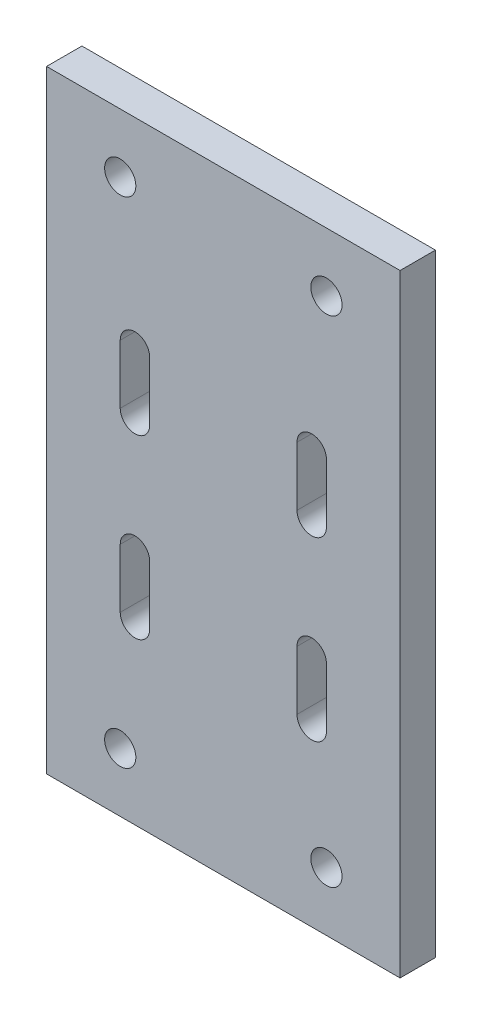
from build123d import *

# Parameters (mm, degrees)
SKETCH_1_W          = 60
SKETCH_1_H          = 104
EXTRUDE_1_DEPTH     = 6
CUT_EXTRUDE_1_DEPTH = 6
SKETCH_4_R          = 2.65
CUT_EXTRUDE_2_DEPTH = 6


with BuildPart() as part:
    # 草图1 → 凸台-拉伸1 (new body)
    with BuildSketch(Plane.XY):
        Rectangle(SKETCH_1_W, SKETCH_1_H)
    extrude(amount=EXTRUDE_1_DEPTH)

    # 草图2 → 切除-拉伸1 (cut)
    with BuildSketch(Plane.XY.offset(6)):
        with BuildLine():
            Line((-12.5, 18), (-12.5, 8))
            ThreePointArc((-12.5, 8), (-15, 5.5), (-17.5, 8))
            Line((-17.5, 8), (-17.5, 18))
            ThreePointArc((-17.5, 18), (-15, 20.5), (-12.5, 18))
        make_face()
        with BuildLine():
            Line((17.5, 18), (17.5, 8))
            ThreePointArc((17.5, 8), (15, 5.5), (12.5, 8))
            Line((12.5, 8), (12.5, 18))
            ThreePointArc((12.5, 18), (15, 20.5), (17.5, 18))
        make_face()
        with BuildLine():
            Line((17.5, -12), (17.5, -22))
            ThreePointArc((17.5, -22), (15, -24.5), (12.5, -22))
            Line((12.5, -22), (12.5, -12))
            ThreePointArc((12.5, -12), (15, -9.5), (17.5, -12))
        make_face()
        with BuildLine():
            Line((-12.5, -12), (-12.5, -22))
            ThreePointArc((-12.5, -22), (-15, -24.5), (-17.5, -22))
            Line((-17.5, -22), (-17.5, -12))
            ThreePointArc((-17.5, -12), (-15, -9.5), (-12.5, -12))
        make_face()
    extrude(amount=-CUT_EXTRUDE_1_DEPTH, mode=Mode.SUBTRACT)

    # 草图4 → 切除-拉伸2 (cut)
    with BuildSketch(Plane.XY.offset(6)):
        with Locations((-17.5, 42)):
            Circle(SKETCH_4_R)
        with Locations((-17.5, -42)):
            Circle(SKETCH_4_R)
        with Locations(Location((17.5, -42, 0), (0, 0, 180))):
            Circle(SKETCH_4_R)
        with Locations(Location((17.5, 42, 0), (0, 0, 180))):
            Circle(SKETCH_4_R)
    extrude(amount=-CUT_EXTRUDE_2_DEPTH, mode=Mode.SUBTRACT)


solid = part.part
